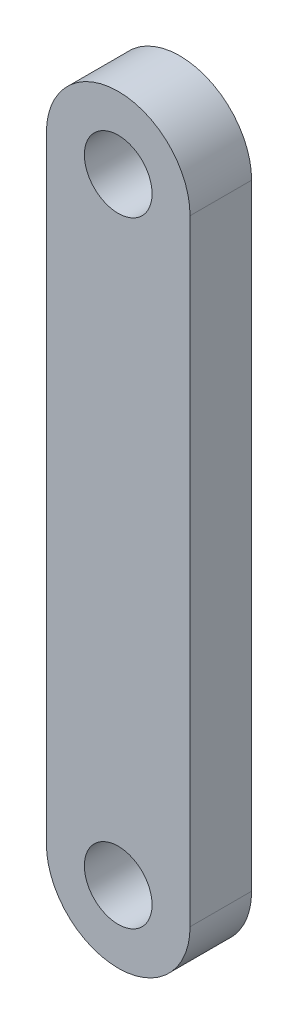
from build123d import *

# Parameters (mm, degrees)
SKETCH_1_R      = 1.65
EXTRUDE_1_DEPTH = 3


with BuildPart() as part:
    # 草图1 → 凸台-拉伸1 (new body)
    with BuildSketch(Plane.XY):
        with BuildLine():
            Line((3.5, 15), (3.5, -15))
            ThreePointArc((3.5, -15), (0, -18.5), (-3.5, -15))
            Line((-3.5, -15), (-3.5, 15))
            ThreePointArc((-3.5, 15), (0, 18.5), (3.5, 15))
        make_face()
        with Locations((0, 15)):
            Circle(SKETCH_1_R, mode=Mode.SUBTRACT)
        with Locations((0, -15)):
            Circle(SKETCH_1_R, mode=Mode.SUBTRACT)
    extrude(amount=EXTRUDE_1_DEPTH)


solid = part.part
